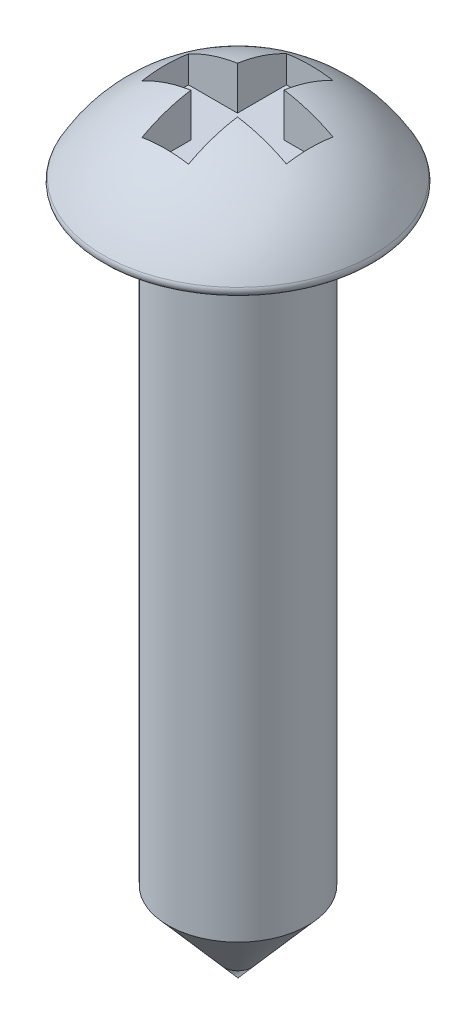
from build123d import *

# Parameters (mm, degrees)
CONG_1_R                = 0.1
ENL_V_MAT_EXTRU_1_DEPTH = 0.5


with BuildPart() as part:
    # Esquisse1 → Révolution1 (revolve)
    with BuildSketch(Plane.XY, mode=Mode.PRIVATE) as r_volution1_sk:
        with BuildLine():
            Line((2.2, 0), (1.1, 0))
            Line((1.1, 0), (1.1, -9.5))
            Line((1.1, -9.5), (0, -10.765529192))
            Line((0, -10.765529192), (0, 1.392961166))
            ThreePointArc((0, 1.392961166), (1.301954378, 1.015441113), (2.2, 0))
        make_face()
    revolve(r_volution1_sk.sketch.rotate(Axis((0, 3.800054794, 0), (0, -1, 0)), 180), axis=Axis((0, 3.800054794, 0), (0, -1, 0)))

    # Congé1
    cong_1_edges = [part.edges().sort_by_distance(p)[0] for p in [
        (2.2, 0, 0),
    ]]
    fillet(cong_1_edges, radius=CONG_1_R)

    # Esquisse2 → Enlèv. mat.-Extru.1 (cut, symmetric)
    with BuildSketch(Plane(origin=(0, 1.15653742, 0), x_dir=(-1, 0, 0), z_dir=(0, 1, 0))):
        Polygon((-0.361948003, 1.140760916), (0.37159995, 1.140760916), (0.37159995, 0.37038863), (1.141972235, 0.37038863), (1.141972235, -0.363159322), (0.37159995, -0.363159322), (0.37159995, -1.133531608), (-0.361948003, -1.133531608), (-0.361948003, -0.363159322), (-1.132320288, -0.363159322), (-1.132320288, 0.37038863), (-0.361948003, 0.37038863), align=None)
    extrude(amount=ENL_V_MAT_EXTRU_1_DEPTH, both=True, mode=Mode.SUBTRACT)


solid = part.part
